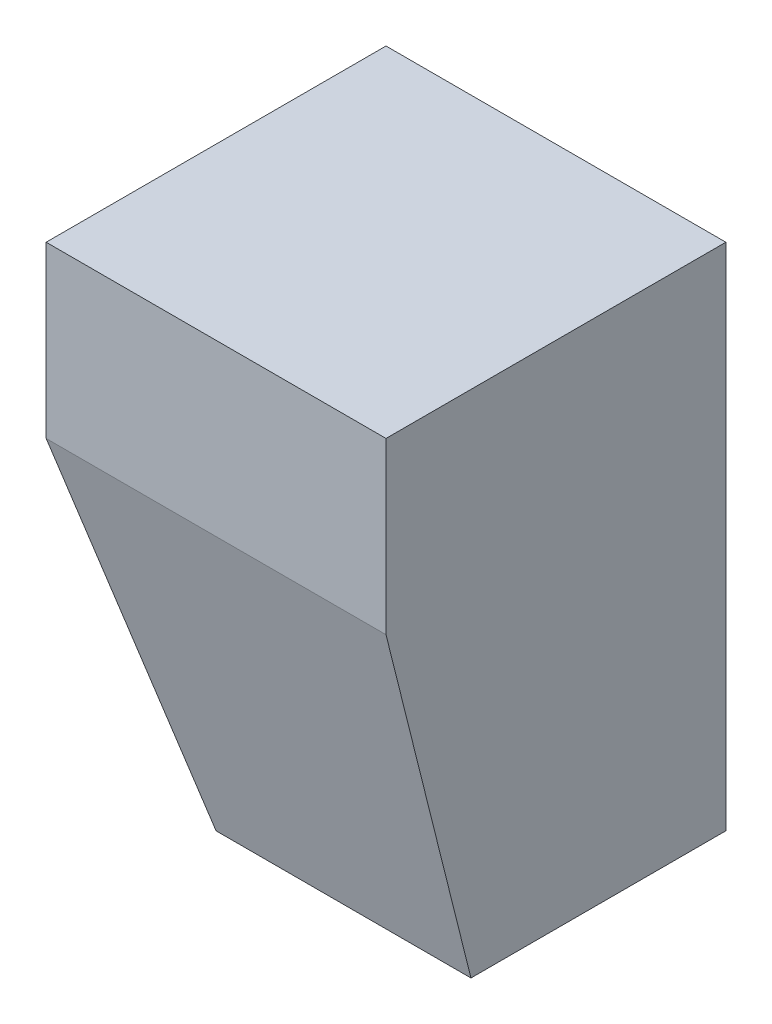
from build123d import *

# Parameters (mm, degrees)
SKETCH1_W           = 50.8
SKETCH1_H           = 50.8
BOSS_EXTRUDE1_DEPTH = 76.2
CHAMFER1_SIZE       = 12.7
CHAMFER1_SIZE2      = 50.8
CHAMFER2_SIZE       = 12.7
CHAMFER2_SIZE2      = 50.8


with BuildPart() as part:
    # Sketch1 → Boss-Extrude1 (new body)
    with BuildSketch(Plane(origin=(0, 0, 0), x_dir=(1, 0, 0), z_dir=(0, 1, 0))):
        Rectangle(SKETCH1_W, SKETCH1_H)
    extrude(amount=BOSS_EXTRUDE1_DEPTH)

    # Chamfer1
    chamfer1_edges = [part.edges().sort_by_distance(p)[0] for p in [
        (0, 0, 25.4),
    ]]
    chamfer1_side = [part.faces().sort_by_distance(p)[0] for p in [
        (0, 0, 0),
    ]]
    chamfer(chamfer1_edges, length=CHAMFER1_SIZE, length2=CHAMFER1_SIZE2, reference=chamfer1_side[0])

    # Chamfer2
    chamfer2_edges = [part.edges().sort_by_distance(p)[0] for p in [
        (-25.4, 0, -6.35),
    ]]
    chamfer2_side = [part.faces().sort_by_distance(p)[0] for p in [
        (0, 0, -6.35),
    ]]
    chamfer(chamfer2_edges, length=CHAMFER2_SIZE, length2=CHAMFER2_SIZE2, reference=chamfer2_side[0])


solid = part.part
